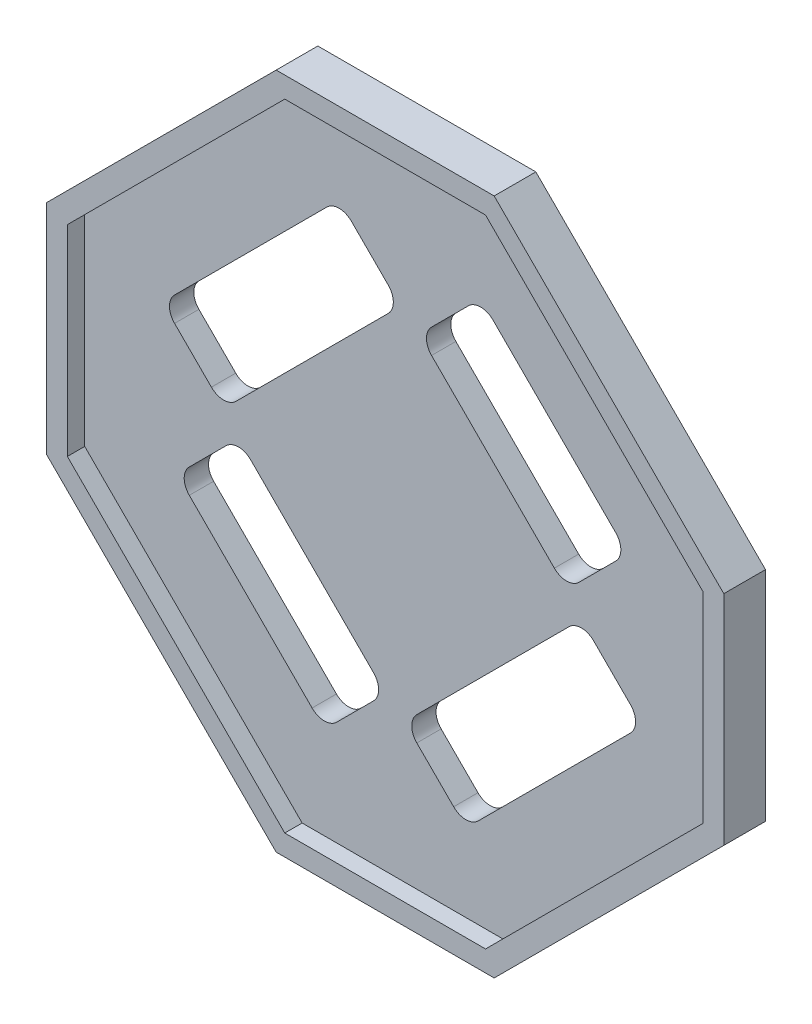
from build123d import *

# Parameters (mm, degrees)
BOSS_EXTRU_1_DEPTH = 3.5
BOSS_EXTRU_2_DEPTH = 6


with BuildPart() as part:
    # Esquisse1 → Boss.-Extru.1 (new body)
    with BuildSketch(Plane.XY):
        Polygon((-45.75, 14.450660172), (-14.450660172, 45.75), (14.450660172, 45.75), (45.75, 14.450660172), (45.75, -14.450660172), (14.450660172, -45.75), (-14.450660172, -45.75), (-45.75, -14.450660172), align=None)
        with BuildLine():
            Line((-13.017835842, 13.017835842), (-2.057680733, 23.97799095))
            ThreePointArc((-2.057680733, 23.97799095), (-1.325447686, 25.745757903), (-2.057680733, 27.513524856))
            Line((-2.057680733, 27.513524856), (-7.360981592, 32.816825715))
            ThreePointArc((-7.360981592, 32.816825715), (-9.128748545, 33.549058762), (-10.896515498, 32.816825715))
            Line((-10.896515498, 32.816825715), (-32.816825715, 10.896515498))
            ThreePointArc((-32.816825715, 10.896515498), (-33.549058762, 9.128748545), (-32.816825715, 7.360981592))
            Line((-32.816825715, 7.360981592), (-27.513524856, 2.057680733))
            ThreePointArc((-27.513524856, 2.057680733), (-25.745757903, 1.325447686), (-23.97799095, 2.057680733))
            Line((-23.97799095, 2.057680733), (-13.017835842, 13.017835842))
        make_face(mode=Mode.SUBTRACT)
        with BuildLine():
            Line((-13.017835842, -13.017835842), (-21.856670606, -4.179001077))
            ThreePointArc((-21.856670606, -4.179001077), (-23.624437559, -3.44676803), (-25.392204512, -4.179001077))
            Line((-25.392204512, -4.179001077), (-30.695505371, -9.482301936))
            ThreePointArc((-30.695505371, -9.482301936), (-31.427738418, -11.250068889), (-30.695505371, -13.017835842))
            Line((-30.695505371, -13.017835842), (-13.017835842, -30.695505371))
            ThreePointArc((-13.017835842, -30.695505371), (-11.250068889, -31.427738418), (-9.482301936, -30.695505371))
            Line((-9.482301936, -30.695505371), (-4.179001077, -25.392204512))
            ThreePointArc((-4.179001077, -25.392204512), (-3.44676803, -23.624437559), (-4.179001077, -21.856670606))
            Line((-4.179001077, -21.856670606), (-13.017835842, -13.017835842))
        make_face(mode=Mode.SUBTRACT)
        with BuildLine():
            Line((27.513524856, -2.057680733), (32.816825715, -7.360981592))
            ThreePointArc((32.816825715, -7.360981592), (33.549058762, -9.128748545), (32.816825715, -10.896515498))
            Line((32.816825715, -10.896515498), (10.896515498, -32.816825715))
            ThreePointArc((10.896515498, -32.816825715), (9.128748545, -33.549058762), (7.360981592, -32.816825715))
            Line((7.360981592, -32.816825715), (2.057680733, -27.513524856))
            ThreePointArc((2.057680733, -27.513524856), (1.325447686, -25.745757903), (2.057680733, -23.97799095))
            Line((2.057680733, -23.97799095), (13.017835842, -13.017835842))
            Line((13.017835842, -13.017835842), (23.97799095, -2.057680733))
            ThreePointArc((23.97799095, -2.057680733), (25.745757903, -1.325447686), (27.513524856, -2.057680733))
        make_face(mode=Mode.SUBTRACT)
        with BuildLine():
            Line((4.179001077, 25.392204512), (9.482301936, 30.695505371))
            ThreePointArc((9.482301936, 30.695505371), (11.250068889, 31.427738418), (13.017835842, 30.695505371))
            Line((13.017835842, 30.695505371), (30.695505371, 13.017835842))
            ThreePointArc((30.695505371, 13.017835842), (31.427738418, 11.250068889), (30.695505371, 9.482301936))
            Line((30.695505371, 9.482301936), (25.392204512, 4.179001077))
            ThreePointArc((25.392204512, 4.179001077), (23.624437559, 3.44676803), (21.856670606, 4.179001077))
            Line((21.856670606, 4.179001077), (13.017835842, 13.017835842))
            Line((13.017835842, 13.017835842), (4.179001077, 21.856670606))
            ThreePointArc((4.179001077, 21.856670606), (3.44676803, 23.624437559), (4.179001077, 25.392204512))
        make_face(mode=Mode.SUBTRACT)
    extrude(amount=BOSS_EXTRU_1_DEPTH)

    # Esquisse2 → Boss.-Extru.2 (add)
    with BuildSketch(Plane.XY):
        Polygon((-48.75, -15.693300859), (-48.75, 15.693300859), (-15.693300859, 48.75), (15.693300859, 48.75), (48.75, 15.693300859), (48.75, -15.693300859), (15.693300859, -48.75), (-15.693300859, -48.75), align=None)
        Polygon((-45.75, 14.450660172), (-14.450660172, 45.75), (14.450660172, 45.75), (45.75, 14.450660172), (45.75, -14.450660172), (14.450660172, -45.75), (-14.450660172, -45.75), (-45.75, -14.450660172), align=None, mode=Mode.SUBTRACT)
    extrude(amount=BOSS_EXTRU_2_DEPTH)


solid = part.part
